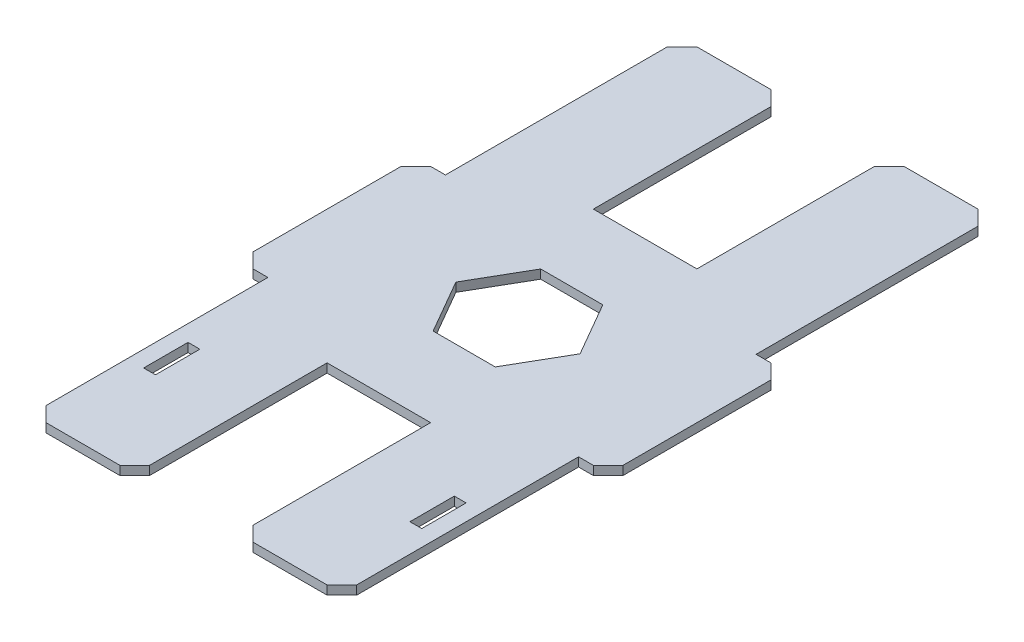
from build123d import *

# Parameters (mm, degrees)
BOSS_EXTRUDE1_DEPTH = 3
CUT_EXTRUDE4_START  = -3
SKETCH8_W           = 35
SKETCH8_H           = 65
CUT_EXTRUDE4_DEPTH  = 3
CUT_EXTRUDE5_DEPTH  = 3
CUT_EXTRUDE6_DEPTH  = 3
SKETCH14_W          = 4
SKETCH14_H          = 15
CUT_EXTRUDE7_DEPTH  = 10


with BuildPart() as part:
    # Sketch1 → Boss-Extrude1 (new body)
    with BuildSketch(Plane(origin=(0, 0, 0), x_dir=(1, 0, 0), z_dir=(0, 1, 0))):
        with BuildLine():
            Line((-10, 0), (-115, 0))
            ThreePointArc((-115, 0), (-122.071067812, 2.928932188), (-125, 10))
            Line((-125, 10), (-125, 210))
            ThreePointArc((-125, 210), (-122.071067812, 217.071067812), (-115, 220))
            Line((-115, 220), (-10, 220))
            ThreePointArc((-10, 220), (-2.928932188, 217.071067812), (0, 210))
            Line((0, 210), (0, 10))
            ThreePointArc((0, 10), (-2.928932188, 2.928932188), (-10, 0))
        make_face()
    extrude(amount=BOSS_EXTRUDE1_DEPTH)

    # Sketch8 → Cut-Extrude4 (cut)
    with BuildSketch(Plane(origin=(0, 3, 0), x_dir=(1, 0, 0), z_dir=(0, 1, 0)).offset(CUT_EXTRUDE4_START)):
        with BuildLine():
            Line((-115, 140), (-115, 220))
            ThreePointArc((-115, 220), (-122.071067812, 217.071067812), (-125, 210))
            Line((-125, 210), (-125, 140))
            Line((-125, 140), (-115, 140))
        make_face()
        with Locations((-62.5, 187.5)):
            Rectangle(SKETCH8_W, SKETCH8_H)
        with BuildLine():
            ThreePointArc((0, 210), (-2.928932188, 217.071067812), (-10, 220))
            Line((-10, 220), (-10, 140))
            Line((-10, 140), (0, 140))
            Line((0, 140), (0, 210))
        make_face()
        with BuildLine():
            Line((0, 10), (0, 80))
            Line((0, 80), (-10, 80))
            Line((-10, 80), (-10, 0))
            ThreePointArc((-10, 0), (-2.928932188, 2.928932188), (0, 10))
        make_face()
        with Locations((-62.5, 32.5)):
            Rectangle(SKETCH8_W, SKETCH8_H)
        with BuildLine():
            Line((-115, 80), (-125, 80))
            Line((-125, 80), (-125, 10))
            ThreePointArc((-125, 10), (-122.071067812, 2.928932188), (-115, 0))
            Line((-115, 0), (-115, 80))
        make_face()
    extrude(amount=CUT_EXTRUDE4_DEPTH, mode=Mode.SUBTRACT)

    # Sketch9 → Cut-Extrude5 (cut)
    with BuildSketch(Plane(origin=(0, 3, 0), x_dir=(1, 0, 0), z_dir=(0, 1, 0))):
        Polygon((-81.876757868, 110.403682456), (-71.381014023, 92.224520853), (-50.389526333, 92.224520853), (-39.893782487, 110.403682456), (-50.389526333, 128.582844059), (-71.381014023, 128.582844059), align=None)
    extrude(amount=-CUT_EXTRUDE5_DEPTH, mode=Mode.SUBTRACT)

    # Sketch12 → Cut-Extrude6 (cut)
    with BuildSketch(Plane(origin=(0, 3, 0), x_dir=(1, 0, 0), z_dir=(0, 1, 0))):
        Polygon((-45, 220), (-45, 215), (-40, 220), align=None)
        Polygon((-80, 220), (-85, 220), (-80, 215), align=None)
        Polygon((-115, 215), (-110, 220), (-115, 220), align=None)
        Polygon((0, 140), (-5, 140), (0, 135), align=None)
        Polygon((0, 80), (0, 85), (-5, 80), align=None)
        Polygon((-125, 135), (-120, 140), (-125, 140), align=None)
        Polygon((-110, 0), (-115, 5), (-115, 0), align=None)
        Polygon((-80, 5), (-85, 0), (-80, 0), align=None)
        Polygon((-40, 0), (-45, 5), (-45, 0), align=None)
        Polygon((-10, 0), (-10, 5), (-15, 0), align=None)
        Polygon((-15, 220), (-10, 220), (-10, 215), align=None)
        Polygon((-125, 85), (-120, 80), (-125, 80), align=None)
    extrude(amount=-CUT_EXTRUDE6_DEPTH, mode=Mode.SUBTRACT)

    # Sketch14 → Cut-Extrude7 (cut)
    with BuildSketch(Plane.XZ):
        with Locations((-17.5, -40)):
            Rectangle(SKETCH14_W, SKETCH14_H)
        with Locations((-107.5, -40)):
            Rectangle(SKETCH14_W, SKETCH14_H)
    extrude(amount=-CUT_EXTRUDE7_DEPTH, mode=Mode.SUBTRACT)


solid = part.part
